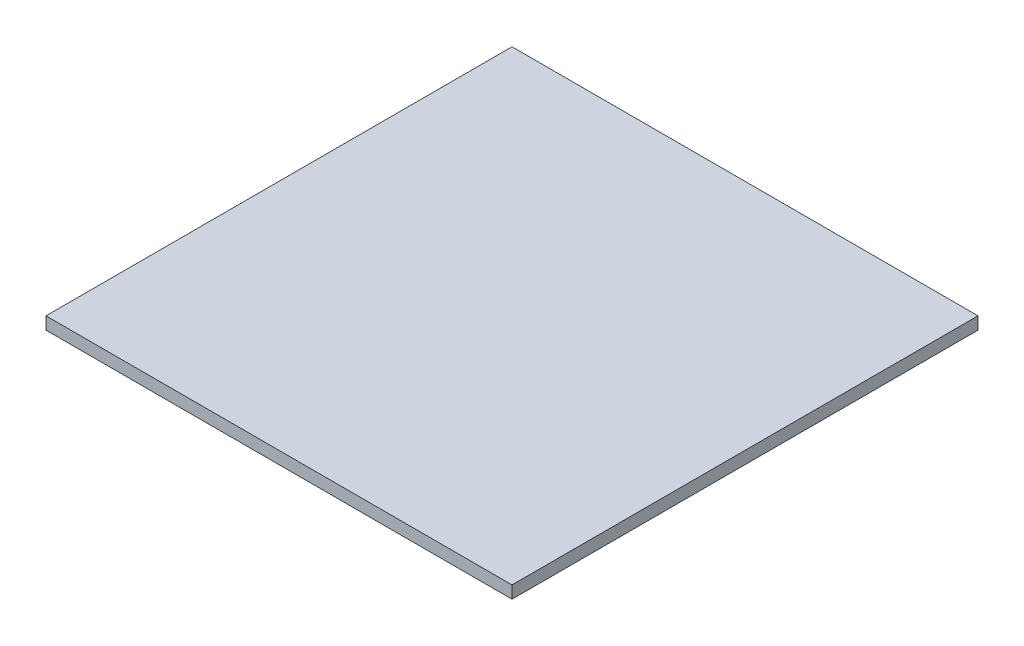
from build123d import *

# Parameters (mm, degrees)
SKETCH_1_W      = 450
SKETCH_1_H      = 450
EXTRUDE_1_DEPTH = 12


with BuildPart() as part:
    # ｽｹｯﾁ1 → ﾎﾞｽ - 押し出し1 (new body)
    with BuildSketch(Plane(origin=(0, 0, 0), x_dir=(1, 0, 0), z_dir=(0, 1, 0))):
        Rectangle(SKETCH_1_W, SKETCH_1_H)
    extrude(amount=EXTRUDE_1_DEPTH)


solid = part.part
